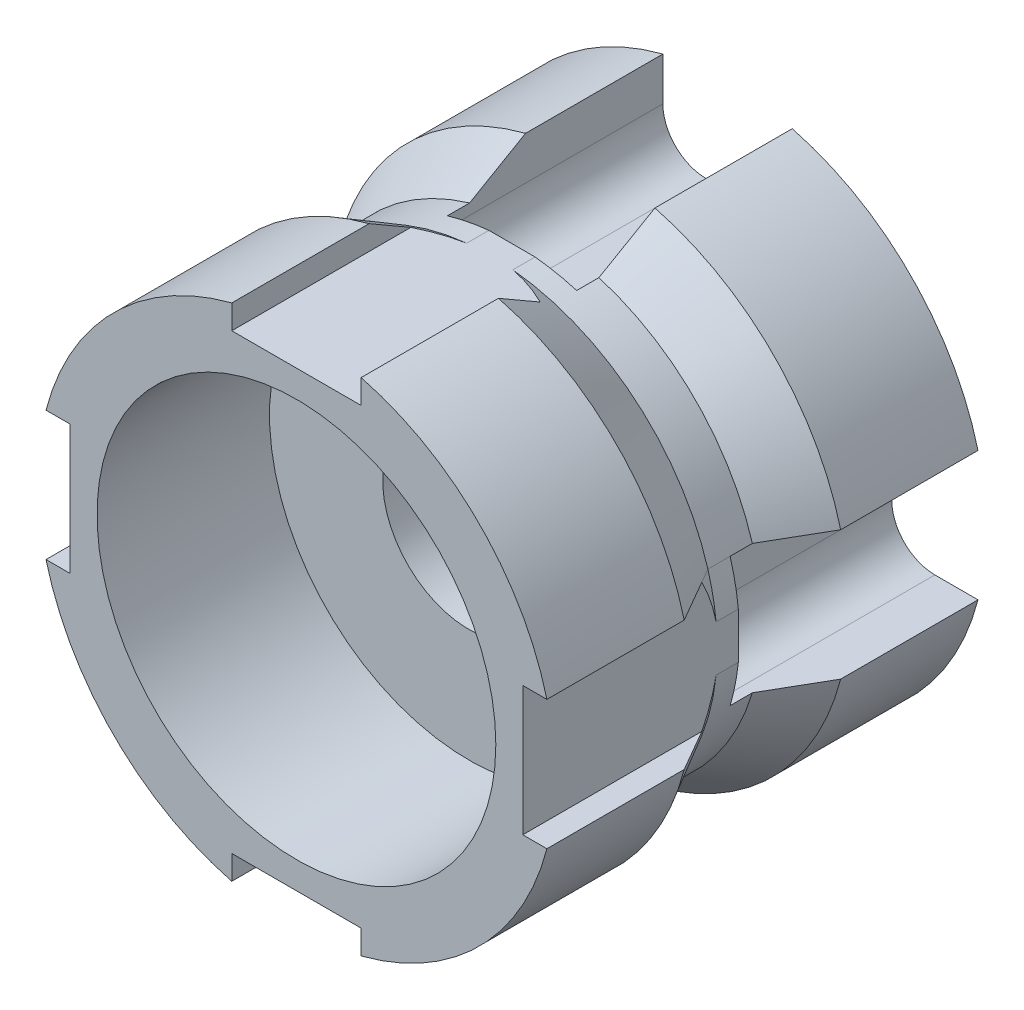
from build123d import *

# Parameters (mm, degrees)
SKETCH1_R           = 5.05
BOSS_EXTRUDE1_DEPTH = 20
SKETCH2_R           = 9.25
CUT_EXTRUDE1_DEPTH  = 8
SKETCH4_R           = 7
SKETCH4_R_2         = 4
BOSS_EXTRUDE2_DEPTH = 2
CUT_EXTRUDE2_DEPTH  = 10


with BuildPart() as part:
    # Sketch1 → Boss-Extrude1 (new body)
    with BuildSketch(Plane.XY):
        with BuildLine():
            Line((-3, 10.5), (3, 10.5))
            Line((3, 10.5), (3, 11.618950039))
            ThreePointArc((3, 11.618950039), (8.485281374, 8.485281374), (11.618950039, 3))
            Line((11.618950039, 3), (10.5, 3))
            Line((10.5, 3), (10.5, -3))
            Line((10.5, -3), (11.618950039, -3))
            ThreePointArc((11.618950039, -3), (8.485281374, -8.485281374), (3, -11.618950039))
            Line((3, -11.618950039), (3, -10.5))
            Line((3, -10.5), (-3, -10.5))
            Line((-3, -10.5), (-3, -11.618950039))
            ThreePointArc((-3, -11.618950039), (-8.485281374, -8.485281374), (-11.618950039, -3))
            Line((-11.618950039, -3), (-10.5, -3))
            Line((-10.5, -3), (-10.5, 3))
            Line((-10.5, 3), (-11.618950039, 3))
            ThreePointArc((-11.618950039, 3), (-8.485281374, 8.485281374), (-3, 11.618950039))
            Line((-3, 11.618950039), (-3, 10.5))
        make_face()
        Circle(SKETCH1_R, mode=Mode.SUBTRACT)
    extrude(amount=BOSS_EXTRUDE1_DEPTH)

    # Sketch2 → Cut-Extrude1 (cut)
    with BuildSketch(Plane.XY.offset(20)):
        Circle(SKETCH2_R)
    extrude(amount=-CUT_EXTRUDE1_DEPTH, mode=Mode.SUBTRACT)

    # Cut-Sweep1: sweep along a curve in space
    with BuildLine() as cut_sweep1_path:
        ThreePointArc((9.25, 0, 20), (6.540737726, 6.540737726, 20), (0, 9.25, 20))
        ThreePointArc((0, 9.25, 20), (-6.540737726, 6.540737726, 20), (-9.25, 0, 20))
        ThreePointArc((-9.25, 0, 20), (-6.540737726, -6.540737726, 20), (0, -9.25, 20))
        ThreePointArc((0, -9.25, 20), (6.540737726, -6.540737726, 20), (9.25, 0, 20))
    # Sketch3 → Cut-Sweep1 (sweep, cut)
    with BuildSketch(Plane.XZ.offset(-3)):
        Polygon((10.118950039, 8.968340129), (10.118950039, 11.031659871), (11.618950039, 13.629736082), (11.618950039, 6.370263918), align=None)
    sweep(path=cut_sweep1_path.line, mode=Mode.SUBTRACT)

    # Sketch4 → Boss-Extrude2 (add)
    with BuildSketch(Plane.XY.offset(12)):
        Circle(SKETCH4_R)
        Circle(SKETCH4_R_2, mode=Mode.SUBTRACT)
    extrude(amount=-BOSS_EXTRUDE2_DEPTH)

    # Sketch5 → Cut-Extrude2 (cut)
    with BuildSketch(Plane(origin=(0, 0, 0), x_dir=(-1, 0, 0), z_dir=(0, 0, -1))):
        with BuildLine():
            Line((-11.618950039, 3), (-9.618950039, 3))
            ThreePointArc((-9.618950039, 3), (-8.204736476, 2.414213562), (-7.618950039, 1))
            Line((-7.618950039, 1), (-7.618950039, -1))
            ThreePointArc((-7.618950039, -1), (-8.204736476, -2.414213562), (-9.618950039, -3))
            Line((-9.618950039, -3), (-11.618950039, -3))
            Line((-11.618950039, -3), (-11.618950039, 3))
        make_face()
        with BuildLine():
            Line((-3, -11.618950039), (3, -11.618950039))
            Line((3, -11.618950039), (3, -9.618950039))
            ThreePointArc((3, -9.618950039), (2.414213562, -8.204736476), (1, -7.618950039))
            Line((1, -7.618950039), (-1, -7.618950039))
            ThreePointArc((-1, -7.618950039), (-2.414213562, -8.204736476), (-3, -9.618950039))
            Line((-3, -9.618950039), (-3, -11.618950039))
        make_face()
        with BuildLine():
            Line((3, 11.618950039), (3, 9.618950039))
            ThreePointArc((3, 9.618950039), (2.414213562, 8.204736476), (1, 7.618950039))
            Line((1, 7.618950039), (-1, 7.618950039))
            ThreePointArc((-1, 7.618950039), (-2.414213562, 8.204736476), (-3, 9.618950039))
            Line((-3, 9.618950039), (-3, 11.618950039))
            Line((-3, 11.618950039), (3, 11.618950039))
        make_face()
        with BuildLine():
            Line((11.618950039, -3), (9.618950039, -3))
            ThreePointArc((9.618950039, -3), (8.204736476, -2.414213562), (7.618950039, -1))
            Line((7.618950039, -1), (7.618950039, 1))
            ThreePointArc((7.618950039, 1), (8.204736476, 2.414213562), (9.618950039, 3))
            Line((9.618950039, 3), (11.618950039, 3))
            Line((11.618950039, 3), (11.618950039, -3))
        make_face()
    extrude(amount=-CUT_EXTRUDE2_DEPTH, mode=Mode.SUBTRACT)


solid = part.part
